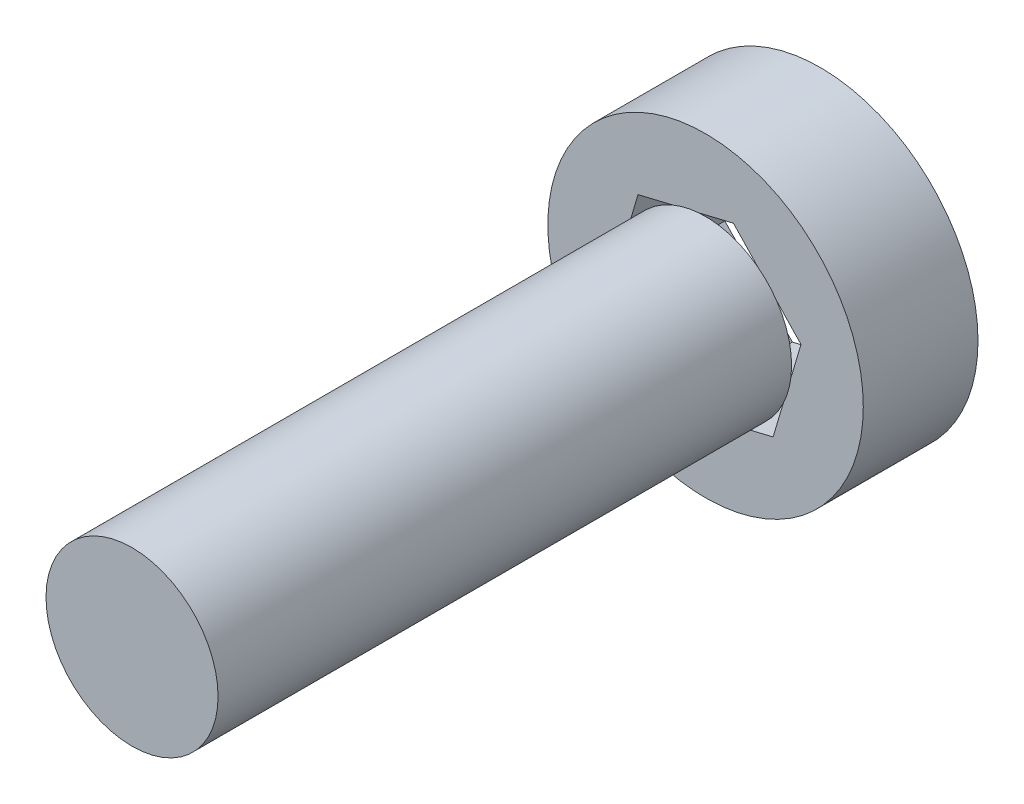
from build123d import *

# Parameters (mm, degrees)
SKETCH_1_R          = 2.75
EXTRUDE_1_DEPTH     = 2
SKETCH_2_R          = 1.5
EXTRUDE_2_DEPTH     = 10
CUT_EXTRUDE_1_DEPTH = 2


with BuildPart() as part:
    # ｽｹｯﾁ1 → ﾎﾞｽ - 押し出し1 (new body)
    with BuildSketch(Plane.XY):
        Circle(SKETCH_1_R)
    extrude(amount=EXTRUDE_1_DEPTH)

    # ｽｹｯﾁ2 → ﾎﾞｽ - 押し出し2 (add)
    with BuildSketch(Plane.XY.offset(2)):
        Circle(SKETCH_2_R)
    extrude(amount=EXTRUDE_2_DEPTH)

    # ｽｹｯﾁ3 → ｶｯﾄ - 押し出し1 (cut)
    with BuildSketch(Plane(origin=(0, 0, 0), x_dir=(-1, 0, 0), z_dir=(0, 0, -1))):
        Polygon((1.66357981, -0.399103763), (1.177423903, 1.241150495), (-0.486155907, 1.640254258), (-1.66357981, 0.399103763), (-1.177423903, -1.241150495), (0.486155907, -1.640254258), align=None)
    extrude(amount=-CUT_EXTRUDE_1_DEPTH, mode=Mode.SUBTRACT)


solid = part.part
